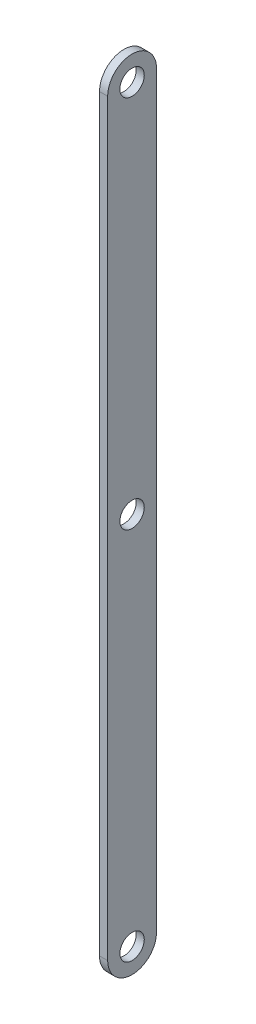
from build123d import *

# Parameters (mm, degrees)
SKETCH1_R           = 7.5
BOSS_EXTRUDE1_DEPTH = 5


with BuildPart() as part:
    # Sketch1 → Boss-Extrude1 (new body)
    with BuildSketch(Plane.YZ):
        with BuildLine():
            Line((-230, 15), (230, 15))
            ThreePointArc((230, 15), (245, 0), (230, -15))
            Line((230, -15), (-230, -15))
            ThreePointArc((-230, -15), (-245, 0), (-230, 15))
        make_face()
        with Locations(Location((-230, 0, 0), (0, 0, 270))):
            Circle(SKETCH1_R, mode=Mode.SUBTRACT)
        with Locations(Location((0, 0, 0), (0, 0, 270))):
            Circle(SKETCH1_R, mode=Mode.SUBTRACT)
        with Locations(Location((230, 0, 0), (0, 0, 270))):
            Circle(SKETCH1_R, mode=Mode.SUBTRACT)
    extrude(amount=-BOSS_EXTRUDE1_DEPTH)


solid = part.part
